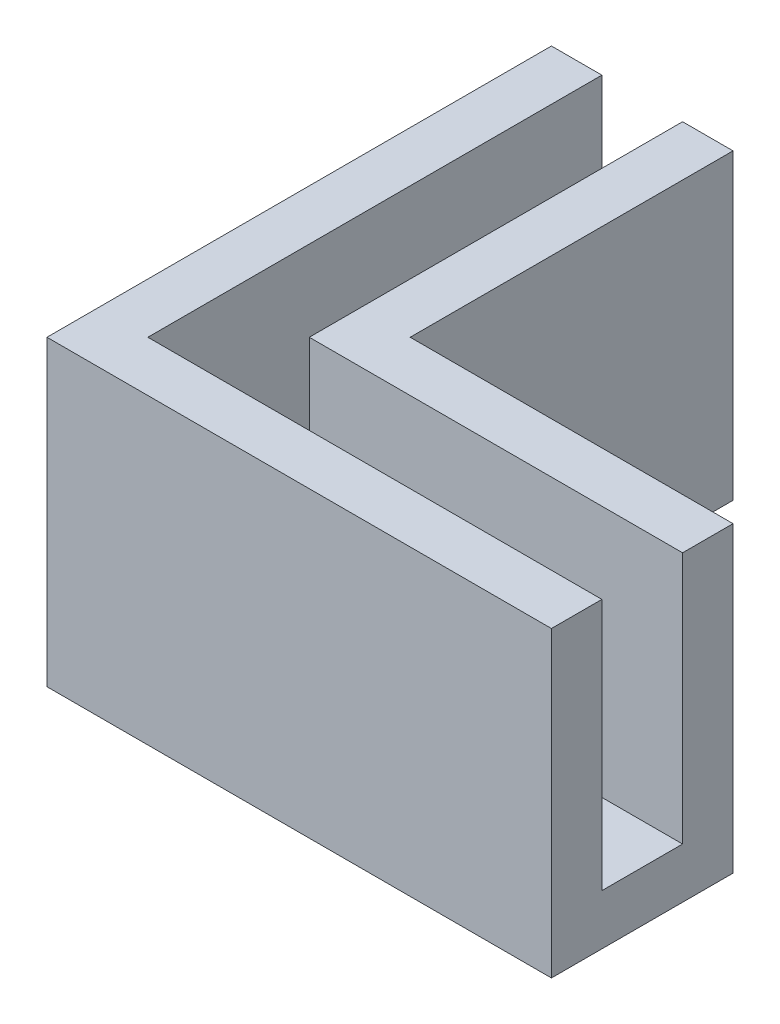
from build123d import *

# Parameters (mm, degrees)
BOSS_EXTRUDE1_DEPTH = 5
BOSS_EXTRUDE2_DEPTH = 30


with BuildPart() as part:
    # Sketch1 → Boss-Extrude1 (new body)
    with BuildSketch(Plane(origin=(0, 0, 0), x_dir=(1, 0, 0), z_dir=(0, 1, 0))):
        Polygon((13, 50), (5, 50), (5, 5), (50, 5), (50, 13), (13, 13), align=None)
    extrude(amount=BOSS_EXTRUDE1_DEPTH)

    # Sketch1<3> → Boss-Extrude2 (add)
    with BuildSketch(Plane(origin=(0, 0, 0), x_dir=(1, 0, 0), z_dir=(0, 1, 0))):
        Polygon((0, 50), (0, 0), (50, 0), (50, 5), (5, 5), (5, 50), align=None)
        Polygon((18, 50), (13, 50), (13, 13), (50, 13), (50, 18), (18, 18), align=None)
    extrude(amount=BOSS_EXTRUDE2_DEPTH)


solid = part.part
